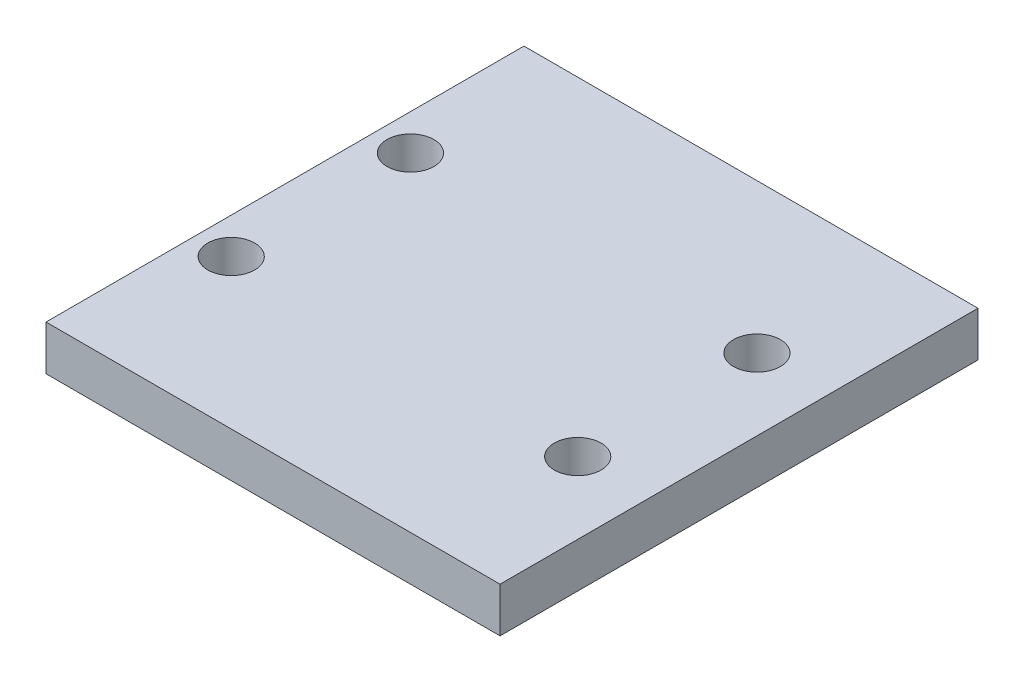
from build123d import *

# Parameters (mm, degrees)
SKETCH1_W           = 48.26
SKETCH1_H           = 50.8
BOSS_EXTRUDE1_DEPTH = 4.7625
SKETCH2_R           = 2.4892
CUT_EXTRUDE1_DEPTH  = 4.7625


with BuildPart() as part:
    # Sketch1 → Boss-Extrude1 (new body)
    with BuildSketch(Plane(origin=(0, 0, 0), x_dir=(1, 0, 0), z_dir=(0, 1, 0))):
        with Locations((24.13, 25.4)):
            Rectangle(SKETCH1_W, SKETCH1_H)
    extrude(amount=BOSS_EXTRUDE1_DEPTH)

    # Sketch2 → Cut-Extrude1 (cut)
    with BuildSketch(Plane(origin=(0, 4.7625, 0), x_dir=(1, 0, 0), z_dir=(0, 1, 0))):
        with Locations(Location((3.81, 15.875, 0), (0, 0, 270))):
            Circle(SKETCH2_R)
        with Locations(Location((40.64, 15.875, 0), (0, 0, 270))):
            Circle(SKETCH2_R)
        with Locations(Location((40.64, 34.925, 0), (0, 0, 270))):
            Circle(SKETCH2_R)
        with Locations(Location((3.81, 34.925, 0), (0, 0, 270))):
            Circle(SKETCH2_R)
    extrude(amount=-CUT_EXTRUDE1_DEPTH, mode=Mode.SUBTRACT)


solid = part.part
